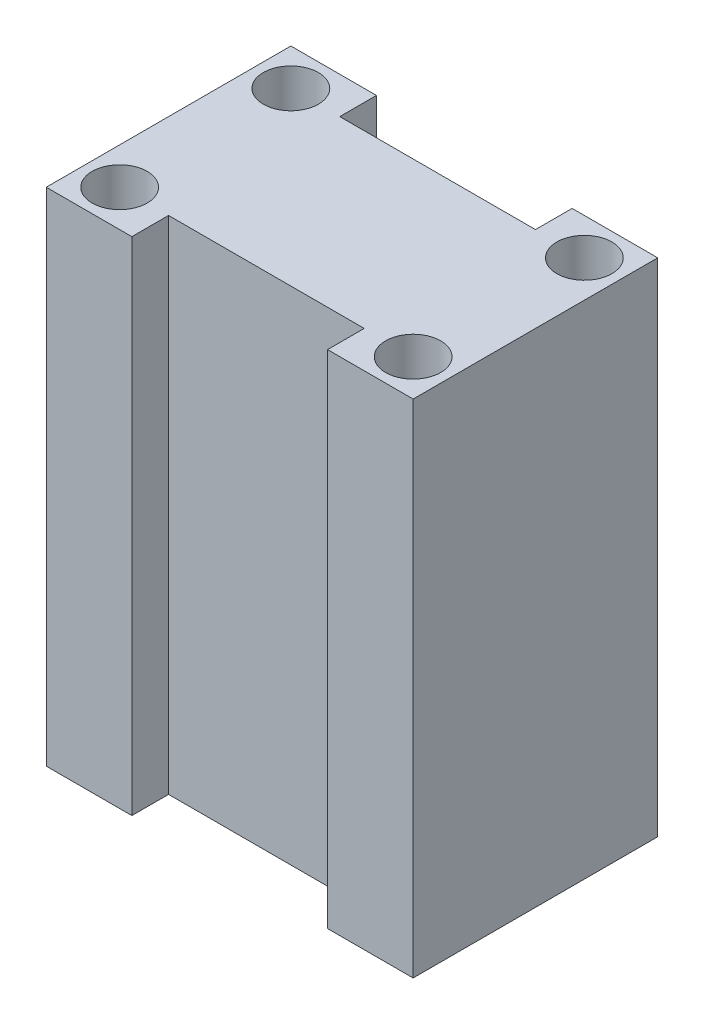
from build123d import *

# Parameters (mm, degrees)
SKETCH_1_W           = 30
SKETCH_1_H           = 20
EXTRUDE_1_DEPTH      = 41
CUT_EXTRUDE_15_REACH = 56.599
SKETCH_17_W          = 7
SKETCH_17_H          = 8
SKETCH_17_W_2        = 16
SKETCH_17_H_2        = 3
SKETCH_20_R          = 2.25
CUT_EXTRUDE_18_DEPTH = 5
SKETCH_21_W          = 8
SKETCH_21_H          = 41
EXTRUDE_2_DEPTH      = 7
SKETCH_22_W          = 8
SKETCH_22_H          = 41
EXTRUDE_3_DEPTH      = 7
CUT_EXTRUDE_START    = -5
SKETCH_23_R          = 2.25
CUT_EXTRUDE_19_DEPTH = 5


with BuildPart() as part:
    # 草图1 → 凸台-拉伸1 (new body)
    with BuildSketch(Plane(origin=(0, 0, 0), x_dir=(1, 0, 0), z_dir=(0, 1, 0))):
        with Locations((-15, 10)):
            Rectangle(SKETCH_1_W, SKETCH_1_H)
    extrude(amount=EXTRUDE_1_DEPTH)

    # 草图17 → 切除-拉伸15 (cut, up to next)
    with BuildSketch(Plane.XZ, mode=Mode.PRIVATE) as cut_extrude_15_sk1:
        with Locations((-26.5, -10)):
            Rectangle(SKETCH_17_W, SKETCH_17_H)
    cut_extrude_15_tool1 = extrude(cut_extrude_15_sk1.sketch, amount=-CUT_EXTRUDE_15_REACH, mode=Mode.PRIVATE) & part.part
    # 草图17 → 切除-拉伸15 (cut, up to next)
    with BuildSketch(Plane.XZ, mode=Mode.PRIVATE) as cut_extrude_15_sk2:
        with Locations((-3.5, -10)):
            Rectangle(SKETCH_17_W, SKETCH_17_H)
    cut_extrude_15_tool2 = extrude(cut_extrude_15_sk2.sketch, amount=-CUT_EXTRUDE_15_REACH, mode=Mode.PRIVATE) & part.part
    # 草图17 → 切除-拉伸15 (cut, up to next)
    with BuildSketch(Plane.XZ, mode=Mode.PRIVATE) as cut_extrude_15_sk3:
        with Locations((-15, -1.5)):
            Rectangle(SKETCH_17_W_2, SKETCH_17_H_2)
    cut_extrude_15_tool3 = extrude(cut_extrude_15_sk3.sketch, amount=-CUT_EXTRUDE_15_REACH, mode=Mode.PRIVATE) & part.part
    # 草图17 → 切除-拉伸15 (cut, up to next)
    with BuildSketch(Plane.XZ, mode=Mode.PRIVATE) as cut_extrude_15_sk4:
        with Locations((-15, -18.5)):
            Rectangle(SKETCH_17_W_2, SKETCH_17_H_2)
    cut_extrude_15_tool4 = extrude(cut_extrude_15_sk4.sketch, amount=-CUT_EXTRUDE_15_REACH, mode=Mode.PRIVATE) & part.part
    add(cut_extrude_15_tool1.solids().sort_by_distance((-26.5, 0, -10))[0], mode=Mode.SUBTRACT)
    add(cut_extrude_15_tool2.solids().sort_by_distance((-3.5, 0, -10))[0], mode=Mode.SUBTRACT)
    add(cut_extrude_15_tool3.solids().sort_by_distance((-15, 0, -1.5))[0], mode=Mode.SUBTRACT)
    add(cut_extrude_15_tool4.solids().sort_by_distance((-15, 0, -18.5))[0], mode=Mode.SUBTRACT)

    # 草图20 → 切除-拉伸18 (cut)
    with BuildSketch(Plane(origin=(0, 41, 0), x_dir=(1, 0, 0), z_dir=(0, 1, 0))):
        with Locations(Location((-27, 17, 0), (0, 0, 270))):
            Circle(SKETCH_20_R)
        with Locations(Location((-27, 3, 0), (0, 0, 270))):
            Circle(SKETCH_20_R)
        with Locations(Location((-3, 3, 0), (0, 0, 270))):
            Circle(SKETCH_20_R)
        with Locations(Location((-3, 17, 0), (0, 0, 270))):
            Circle(SKETCH_20_R)
    extrude(amount=-CUT_EXTRUDE_18_DEPTH, mode=Mode.SUBTRACT)

    # 草图21 → 凸台-拉伸2 (add)
    with BuildSketch(Plane(origin=(-7, 0, 0), x_dir=(0, 0, -1), z_dir=(1, 0, 0))):
        with Locations((10, 20.5)):
            Rectangle(SKETCH_21_W, SKETCH_21_H)
    extrude(amount=EXTRUDE_2_DEPTH)

    # 草图22 → 凸台-拉伸3 (add)
    with BuildSketch(Plane.ZY.offset(23)):
        with Locations((-10, 20.5)):
            Rectangle(SKETCH_22_W, SKETCH_22_H)
    extrude(amount=EXTRUDE_3_DEPTH)

    # 草图23 → 切除-拉伸19 (cut)
    with BuildSketch(Plane.XZ.offset(CUT_EXTRUDE_START)):
        with Locations(Location((-3, -17, 0), (0, 0, 90))):
            Circle(SKETCH_23_R)
        with Locations(Location((-27, -17, 0), (0, 0, 90))):
            Circle(SKETCH_23_R)
        with Locations(Location((-27, -3, 0), (0, 0, 90))):
            Circle(SKETCH_23_R)
        with Locations(Location((-3, -3, 0), (0, 0, 90))):
            Circle(SKETCH_23_R)
    extrude(amount=CUT_EXTRUDE_19_DEPTH, mode=Mode.SUBTRACT)


solid = part.part
